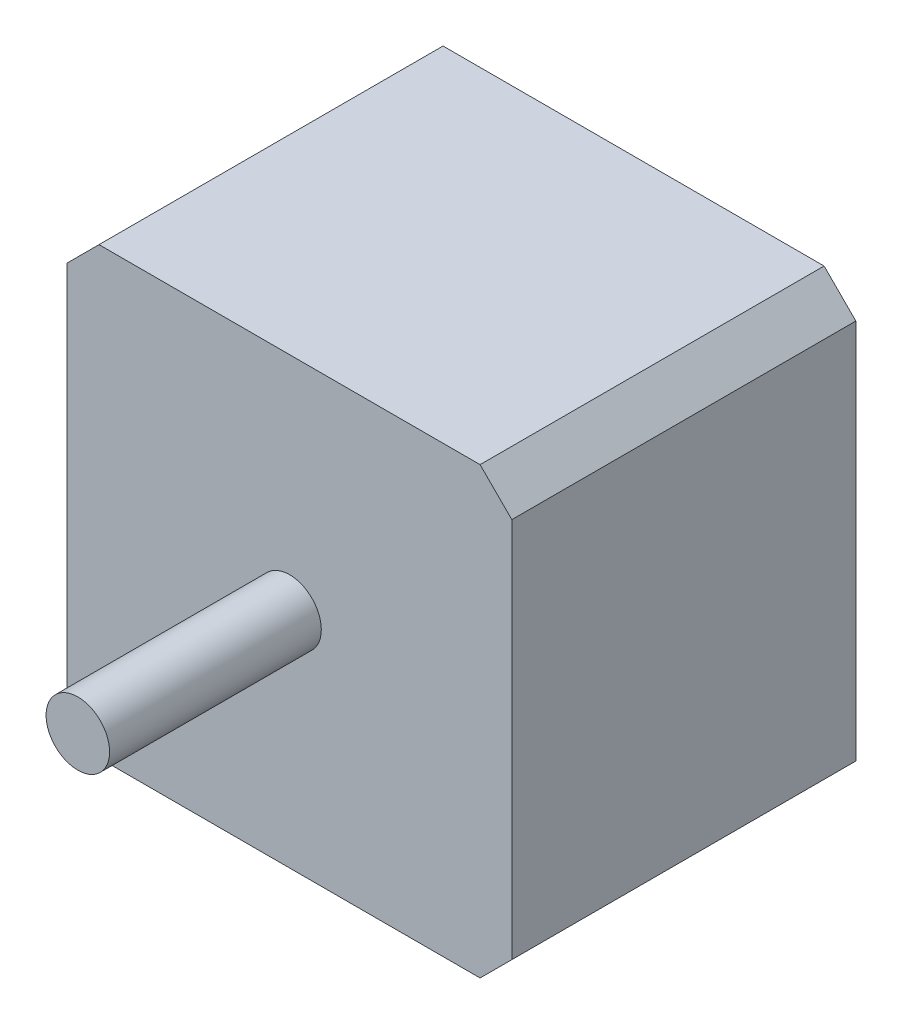
from build123d import *

# Parameters (mm, degrees)
SKETCH1_W           = 42
SKETCH1_H           = 42
BOSS_EXTRUDE1_DEPTH = 32.5
CHAMFER1_SIZE       = 3
SKETCH2_R           = 3
BOSS_EXTRUDE2_DEPTH = 20


with BuildPart() as part:
    # Sketch1 → Boss-Extrude1 (new body)
    with BuildSketch(Plane(origin=(0, 0, 0), x_dir=(0, 1, 0), z_dir=(0, 0, 1))):
        Rectangle(SKETCH1_W, SKETCH1_H)
    extrude(amount=BOSS_EXTRUDE1_DEPTH)

    # Chamfer1
    chamfer1_edges = [part.edges().sort_by_distance(p)[0] for p in [
        (21, 21, 16.25),
        (21, -21, 16.25),
        (-21, -21, 16.25),
        (-21, 21, 16.25),
    ]]
    chamfer(chamfer1_edges, length=CHAMFER1_SIZE)

    # Sketch2 → Boss-Extrude2 (add)
    with BuildSketch(Plane.XY.offset(32.5)):
        Circle(SKETCH2_R)
    extrude(amount=BOSS_EXTRUDE2_DEPTH)


solid = part.part
